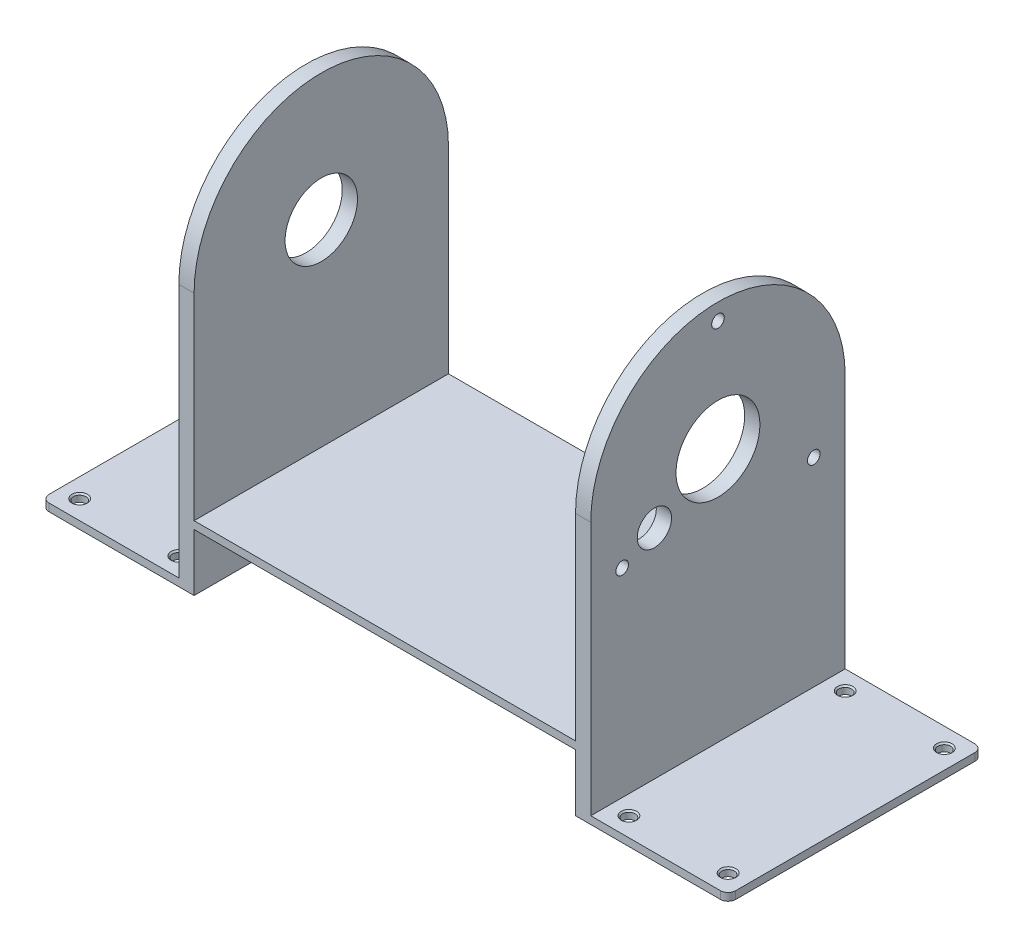
from build123d import *

# Parameters (mm, degrees)
SKETCH_1_W                   = 40
SKETCH_1_H                   = 66.7
EXTRUDE_1_DEPTH              = 2
SKETCH_2_W                   = 4
SKETCH_2_H                   = 66.7
EXTRUDE_2_DEPTH              = 100
CUT_EXTRUDE_1_DEPTH          = 115.526077816
CUT_EXTRUDE_1_DEPTH_BACK     = 115.526077816
HOLE_WIZARD_M4_1_D           = 3.3
HOLE_WIZARD_M4_1_CSINK_D     = 4.05
HOLE_WIZARD_M4_1_CSINK_ANGLE = 90
HOLE_WIZARD_M4_2_AT_2_COUNT  = 2
HOLE_WIZARD_M4_2_AT_2_PITCH  = 68.59294731
HOLE_WIZARD_M4_2_AT_3_COUNT  = 2
HOLE_WIZARD_M4_2_AT_3_PITCH  = 26
HOLE_WIZARD_M4_2_AT_4_COUNT  = 2
HOLE_WIZARD_M4_2_AT_4_PITCH  = 62.376998966
HOLE_WIZARD_M4_2_AT_5_COUNT  = 2
HOLE_WIZARD_M4_2_AT_5_PITCH  = 56.7
SKETCH_11_W                  = 66.7
SKETCH_11_H                  = 2
EXTRUDE_3_DEPTH              = 100
SKETCH_13_W                  = 40
SKETCH_13_H                  = 66.7
EXTRUDE_4_DEPTH              = 2
SKETCH_14_W                  = 4
SKETCH_14_H                  = 66.7
EXTRUDE_5_DEPTH              = 100
CUT_EXTRUDE_2_DEPTH          = 180.589037806
CUT_EXTRUDE_2_DEPTH_BACK     = 180.589037806
HOLE_WIZARD_M4_3_AT_2_COUNT  = 2
HOLE_WIZARD_M4_3_AT_2_PITCH  = 26
HOLE_WIZARD_M4_3_AT_3_COUNT  = 2
HOLE_WIZARD_M4_3_AT_3_PITCH  = 62.376998966
HOLE_WIZARD_M4_3_AT_4_COUNT  = 2
HOLE_WIZARD_M4_3_AT_4_PITCH  = 56.7
CUT_EXTRUDE_3_REACH          = 181.589
SKETCH_18_R                  = 9.5
CUT_EXTRUDE_4_REACH          = 181.589
SKETCH_21_R                  = 11
CUT_EXTRUDE_5_REACH          = 181.589
SKETCH_22_R                  = 4.5
FILLET_1_R                   = 2


with BuildPart() as part:
    # 草图1 → 凸台-拉伸1 (new body)
    with BuildSketch(Plane(origin=(0, 0, 0), x_dir=(1, 0, 0), z_dir=(0, 1, 0))):
        Rectangle(SKETCH_1_W, SKETCH_1_H)
    extrude(amount=EXTRUDE_1_DEPTH)

    # 草图2 → 凸台-拉伸2 (add)
    with BuildSketch(Plane(origin=(0, 2, 0), x_dir=(1, 0, 0), z_dir=(0, 1, 0))):
        with Locations((-18, 0)):
            Rectangle(SKETCH_2_W, SKETCH_2_H)
    extrude(amount=EXTRUDE_2_DEPTH)

    # 草图5 → 切除-拉伸1 (cut, two sides: drawn at the far end of the back side and taken through both)
    with BuildSketch(Plane.ZY.offset(20).offset(-CUT_EXTRUDE_1_DEPTH_BACK)):
        with BuildLine():
            ThreePointArc((0, 102), (23.582011153, 92.232011153), (33.35, 68.65))
            Line((33.35, 68.65), (33.35, 102))
            Line((33.35, 102), (0, 102))
        make_face()
        with BuildLine():
            ThreePointArc((-33.35, 68.65), (-23.582011153, 92.232011153), (0, 102))
            Line((0, 102), (-33.35, 102))
            Line((-33.35, 102), (-33.35, 68.65))
        make_face()
    extrude(amount=CUT_EXTRUDE_1_DEPTH + CUT_EXTRUDE_1_DEPTH_BACK, mode=Mode.SUBTRACT)

    # M4 螺纹孔1 (through all)
    with Locations(Plane.ZY.offset(20)):
        with Locations((0, 97.65), (25.11473671, 54.15), (-25.11473671, 54.15)):
            CounterSinkHole(HOLE_WIZARD_M4_1_D / 2, HOLE_WIZARD_M4_1_CSINK_D / 2, counter_sink_angle=HOLE_WIZARD_M4_1_CSINK_ANGLE)

    # 草图10 → M4 螺纹孔2 (revolve, cut)
    with BuildSketch(Plane(origin=(15, 2, -28.35), x_dir=(0, 0, 1), z_dir=(1, 0, 0))):
        Polygon((0, 0), (0, 2), (1.65, 2), (1.65, 0.375), (2.025, 0), align=None)
    hole_wizard_m4_2 = revolve(axis=Axis((15, 8.35, -28.35), (0, -1, 0)), mode=Mode.SUBTRACT)

    # M4 螺纹孔2 at 2: M4 螺纹孔2 ×2
    with Locations(*[Vector(-0.9508085645250022, 0, 0.3097790722852413) * (i * HOLE_WIZARD_M4_2_AT_2_PITCH) for i in range(1, HOLE_WIZARD_M4_2_AT_2_COUNT)]):
        add(hole_wizard_m4_2, mode=Mode.SUBTRACT)

    # M4 螺纹孔2 at 3: M4 螺纹孔2 ×2
    with Locations(*[(-i * HOLE_WIZARD_M4_2_AT_3_PITCH, 0, 0) for i in range(1, HOLE_WIZARD_M4_2_AT_3_COUNT)]):
        add(hole_wizard_m4_2, mode=Mode.SUBTRACT)

    # M4 螺纹孔2 at 4: M4 螺纹孔2 ×2
    with Locations(*[Vector(-0.4168203092647413, 0, 0.9089889052042635) * (i * HOLE_WIZARD_M4_2_AT_4_PITCH) for i in range(1, HOLE_WIZARD_M4_2_AT_4_COUNT)]):
        add(hole_wizard_m4_2, mode=Mode.SUBTRACT)

    # M4 螺纹孔2 at 5: M4 螺纹孔2 ×2
    with Locations(*[(0, 0, i * HOLE_WIZARD_M4_2_AT_5_PITCH) for i in range(1, HOLE_WIZARD_M4_2_AT_5_COUNT)]):
        add(hole_wizard_m4_2, mode=Mode.SUBTRACT)

    # 草图11 → 凸台-拉伸3 (add)
    with BuildSketch(Plane.ZY.offset(20)):
        with Locations((0, 16)):
            Rectangle(SKETCH_11_W, SKETCH_11_H)
    extrude(amount=EXTRUDE_3_DEPTH)



with BuildPart() as body_2:
    # 草图13 → 凸台-拉伸4 (new body)
    with BuildSketch(Plane(origin=(0, 0, 0), x_dir=(1, 0, 0), z_dir=(0, 1, 0))):
        with Locations((-140, 0)):
            Rectangle(SKETCH_13_W, SKETCH_13_H)
    extrude(amount=EXTRUDE_4_DEPTH)


with BuildPart() as part_1:
    add(part.part)

    add(body_2.part)  # 凸台-拉伸5 merges body 2
    # 草图14 → 凸台-拉伸5 (add)
    with BuildSketch(Plane(origin=(0, 2, 0), x_dir=(1, 0, 0), z_dir=(0, 1, 0))):
        with Locations((-122, 0)):
            Rectangle(SKETCH_14_W, SKETCH_14_H)
    extrude(amount=EXTRUDE_5_DEPTH)

    # 草图15 → 切除-拉伸2 (cut, two sides: drawn at the far end of the back side and taken through both)
    with BuildSketch(Plane.ZY.offset(124).offset(-CUT_EXTRUDE_2_DEPTH_BACK)):
        with BuildLine():
            ThreePointArc((0, 102), (23.582011153, 92.232011153), (33.35, 68.65))
            Line((33.35, 68.65), (33.35, 102))
            Line((33.35, 102), (0, 102))
        make_face()
        with BuildLine():
            ThreePointArc((-33.35, 68.65), (-23.582011153, 92.232011153), (0, 102))
            Line((0, 102), (-33.35, 102))
            Line((-33.35, 102), (-33.35, 68.65))
        make_face()
    extrude(amount=CUT_EXTRUDE_2_DEPTH + CUT_EXTRUDE_2_DEPTH_BACK, mode=Mode.SUBTRACT)

    # 草图17 → M4 螺纹孔3 (revolve, cut)
    with BuildSketch(Plane(origin=(-129, 2, -28.35), x_dir=(0, 0, 1), z_dir=(1, 0, 0))):
        Polygon((0, 0), (0, 2), (1.65, 2), (1.65, 0.375), (2.025, 0), align=None)
    hole_wizard_m4_3 = revolve(axis=Axis((-129, 8.35, -28.35), (0, -1, 0)), mode=Mode.SUBTRACT)

    # M4 螺纹孔3 at 2: M4 螺纹孔3 ×2
    with Locations(*[(-i * HOLE_WIZARD_M4_3_AT_2_PITCH, 0, 0) for i in range(1, HOLE_WIZARD_M4_3_AT_2_COUNT)]):
        add(hole_wizard_m4_3, mode=Mode.SUBTRACT)

    # M4 螺纹孔3 at 3: M4 螺纹孔3 ×2
    with Locations(*[Vector(-0.41682030926474106, 0, 0.9089889052042636) * (i * HOLE_WIZARD_M4_3_AT_3_PITCH) for i in range(1, HOLE_WIZARD_M4_3_AT_3_COUNT)]):
        add(hole_wizard_m4_3, mode=Mode.SUBTRACT)

    # M4 螺纹孔3 at 4: M4 螺纹孔3 ×2
    with Locations(*[(0, 0, i * HOLE_WIZARD_M4_3_AT_4_PITCH) for i in range(1, HOLE_WIZARD_M4_3_AT_4_COUNT)]):
        add(hole_wizard_m4_3, mode=Mode.SUBTRACT)

    # 草图18 → 切除-拉伸3 (cut, up to next)
    with BuildSketch(Plane.ZY.offset(124), mode=Mode.PRIVATE) as cut_extrude_3_sk1:
        with Locations((0, 68.65)):
            Circle(SKETCH_18_R)
    cut_extrude_3_tool1 = extrude(cut_extrude_3_sk1.sketch, amount=-CUT_EXTRUDE_3_REACH, mode=Mode.PRIVATE) & part_1.part
    add(cut_extrude_3_tool1.solids().sort_by_distance((-124, 68.65, 0))[0], mode=Mode.SUBTRACT)

    # 草图21 → 切除-拉伸4 (cut, up to next)
    with BuildSketch(Plane(origin=(-16, 0, 0), x_dir=(0, 0, -1), z_dir=(1, 0, 0)), mode=Mode.PRIVATE) as cut_extrude_4_sk1:
        with Locations((0, 68.65)):
            Circle(SKETCH_21_R)
    cut_extrude_4_tool1 = extrude(cut_extrude_4_sk1.sketch, amount=-CUT_EXTRUDE_4_REACH, mode=Mode.PRIVATE) & part_1.part
    add(cut_extrude_4_tool1.solids().sort_by_distance((-16, 68.65, 0))[0], mode=Mode.SUBTRACT)

    # 草图22 → 切除-拉伸5 (cut, up to next)
    with BuildSketch(Plane(origin=(-16, 0, 0), x_dir=(0, 0, -1), z_dir=(1, 0, 0)), mode=Mode.PRIVATE) as cut_extrude_5_sk1:
        with Locations((-16.670989023, 59.025)):
            Circle(SKETCH_22_R)
    cut_extrude_5_tool1 = extrude(cut_extrude_5_sk1.sketch, amount=-CUT_EXTRUDE_5_REACH, mode=Mode.PRIVATE) & part_1.part
    add(cut_extrude_5_tool1.solids().sort_by_distance((-16, 59.025, 16.670989))[0], mode=Mode.SUBTRACT)

    # 圆角1
    fillet_1_edges = [part_1.edges().sort_by_distance(p)[0] for p in [
        (-160, 1, -33.35),
        (-160, 1, 33.35),
        (20, 1, 33.35),
        (20, 1, -33.35),
    ]]
    fillet(fillet_1_edges, radius=FILLET_1_R)


solid = part_1.part
